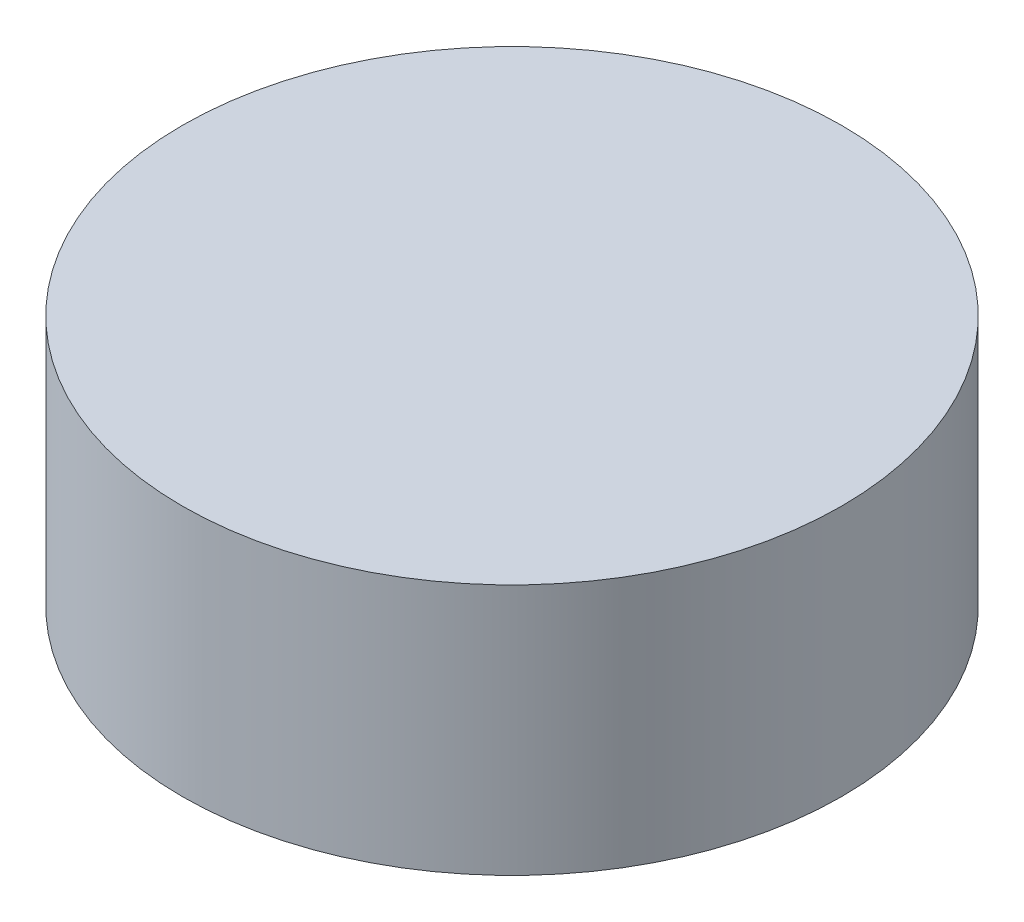
from build123d import *

# Parameters (mm, degrees)
SKETCH1_R           = 19
BOSS_EXTRUDE1_DEPTH = 14.5


with BuildPart() as part:
    # Sketch1 → Boss-Extrude1 (new body)
    with BuildSketch(Plane(origin=(0, 0, 0), x_dir=(1, 0, 0), z_dir=(0, 1, 0))):
        with Locations(Location((0, 0, 0), (0, 0, 270))):
            Circle(SKETCH1_R)
    extrude(amount=BOSS_EXTRUDE1_DEPTH)


solid = part.part
